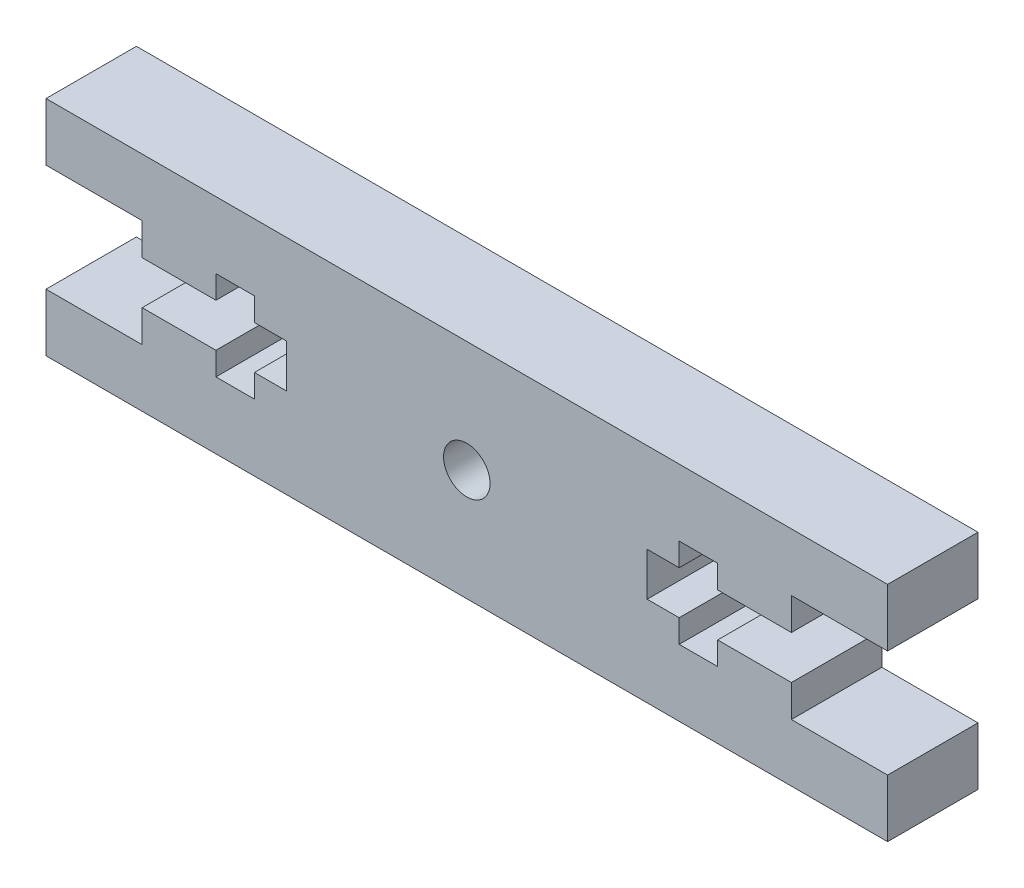
from build123d import *

# Parameters (mm, degrees)
SKETCH1_R           = 1.45
BOSS_EXTRUDE2_DEPTH = 5.64


with BuildPart() as part:
    # Sketch1 → Boss-Extrude2 (new body)
    with BuildSketch(Plane.XY):
        Polygon((727.33944815, 352.606300382), (779.83944815, 352.606300382), (779.83944815, 349.006300382), (773.83944815, 349.006300382), (773.83944815, 347.006300382), (769.23944815, 347.006300382), (769.23944815, 348.446300382), (766.83944815, 348.446300382), (766.83944815, 347.006300382), (764.83944815, 347.006300382), (764.83944815, 344.306300382), (766.83944815, 344.306300382), (766.83944815, 342.866300382), (769.23944815, 342.866300382), (769.23944815, 344.306300382), (773.83944815, 344.306300382), (773.83944815, 342.306300382), (779.83944815, 342.306300382), (779.83944815, 338.706300382), (727.33944815, 338.706300382), (727.33944815, 342.306300382), (733.33944815, 342.306300382), (733.33944815, 344.306300382), (737.93944815, 344.306300382), (737.93944815, 342.866300382), (740.33944815, 342.866300382), (740.33944815, 344.306300382), (742.33944815, 344.306300382), (742.33944815, 347.006300382), (740.33944815, 347.006300382), (740.33944815, 348.446300382), (737.93944815, 348.446300382), (737.93944815, 347.006300382), (733.33944815, 347.006300382), (733.33944815, 349.006300382), (727.33944815, 349.006300382), align=None)
        with Locations((753.58944815, 345.656300382)):
            Circle(SKETCH1_R, mode=Mode.SUBTRACT)
    extrude(amount=BOSS_EXTRUDE2_DEPTH)


solid = part.part
